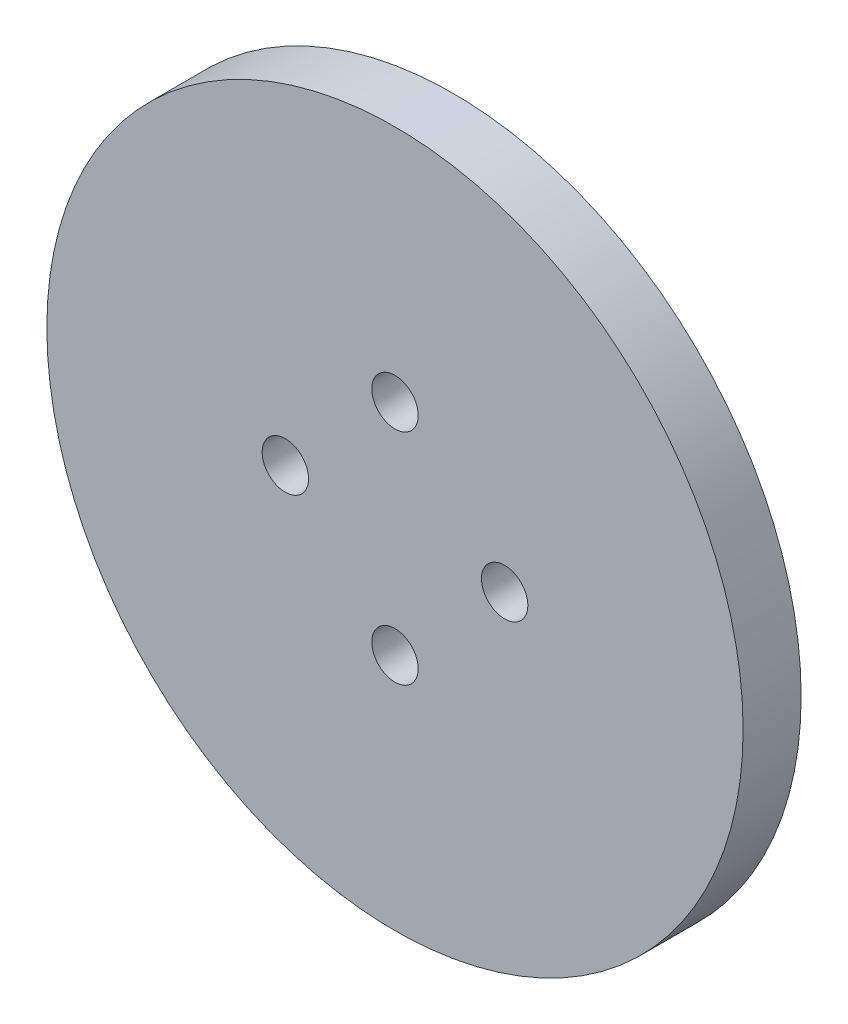
from build123d import *

# Parameters (mm, degrees)
SKETCH1_R           = 38.1
SKETCH1_R_2         = 2.54
BOSS_EXTRUDE1_DEPTH = 6.35


with BuildPart() as part:
    # Sketch1 → Boss-Extrude1 (new body)
    with BuildSketch(Plane.XY):
        Circle(SKETCH1_R)
        with Locations((12, 0)):
            Circle(SKETCH1_R_2, mode=Mode.SUBTRACT)
        with Locations((0, -12)):
            Circle(SKETCH1_R_2, mode=Mode.SUBTRACT)
        with Locations((-12, 0)):
            Circle(SKETCH1_R_2, mode=Mode.SUBTRACT)
        with Locations((0, 12)):
            Circle(SKETCH1_R_2, mode=Mode.SUBTRACT)
    extrude(amount=BOSS_EXTRUDE1_DEPTH)


solid = part.part
